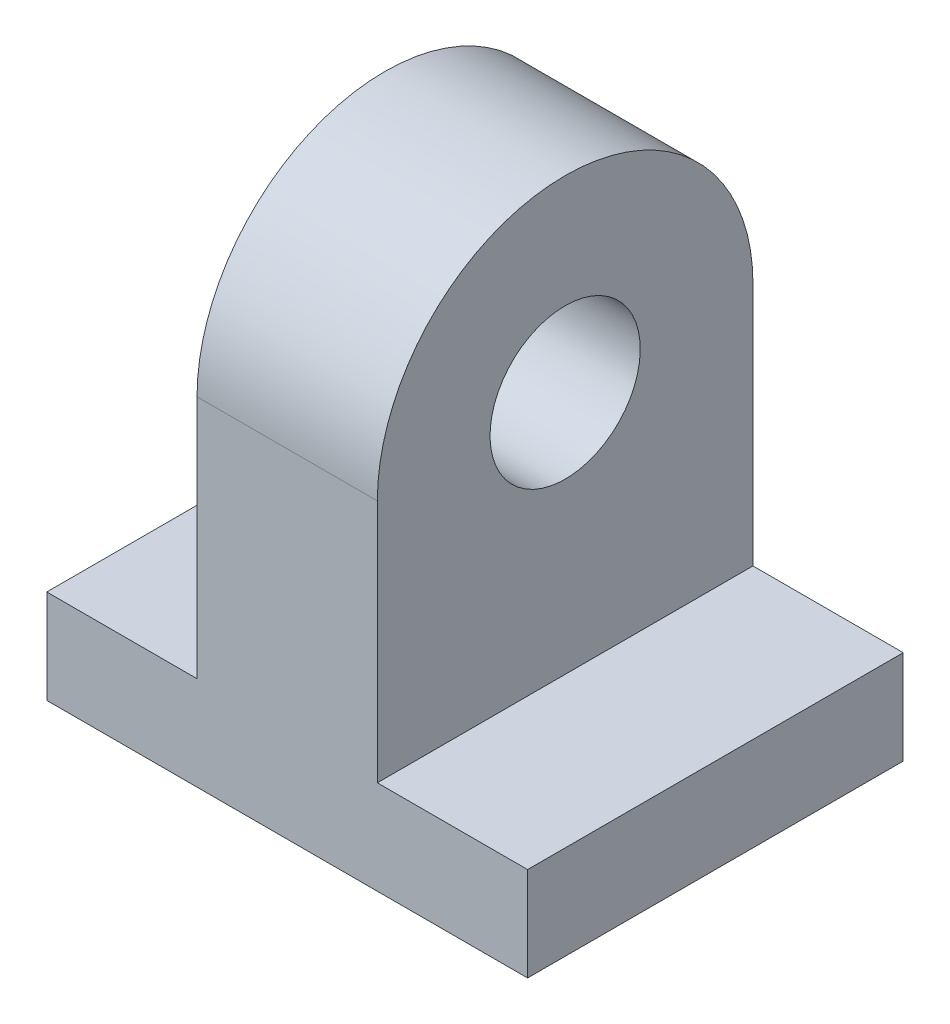
from build123d import *

# Parameters (mm, degrees)
EXTRUDE_1_DEPTH     = 10
SKETCH_2_OUTSIDE_W  = 16.288
SKETCH_2_OUTSIDE_H  = 20.288
SKETCH_2_OUTSIDE_R  = 2
CUT_EXTRUDE_3_DEPTH = 20.324595727


with BuildPart() as part:
    # Эскиз1 → Бобышка-Вытянуть1 (new body)
    with BuildSketch(Plane.XY):
        Polygon((-6.4, 0), (6.4, 0), (6.4, 2.5), (2.4, 2.5), (2.4, 14), (-2.4, 14), (-2.4, 2.5), (-6.4, 2.5), align=None)
    extrude(amount=EXTRUDE_1_DEPTH)

    # Эскиз2 outside → Вырез-Вытянуть3 (cut, through all)
    # profile 1 of 2: a face of its own
    with BuildSketch(Plane(origin=(2.4, 0, 0), x_dir=(0, 0, -1), z_dir=(1, 0, 0))):
        with Locations((-5, 7)):
            Rectangle(SKETCH_2_OUTSIDE_W, SKETCH_2_OUTSIDE_H)
        with BuildLine():
            Line((-10, 9), (-10, 0))
            Line((-10, 0), (0, 0))
            Line((0, 0), (0, 9))
            ThreePointArc((0, 9), (-5, 14), (-10, 9))
        make_face(mode=Mode.SUBTRACT)
    # profile 2 of 2: a face of its own
    with BuildSketch(Plane(origin=(2.4, 0, 0), x_dir=(0, 0, -1), z_dir=(1, 0, 0))):
        with Locations(Location((-5, 9, 0), (0, 0, 90))):
            Circle(SKETCH_2_OUTSIDE_R)
    extrude(amount=-CUT_EXTRUDE_3_DEPTH, mode=Mode.SUBTRACT)


solid = part.part
